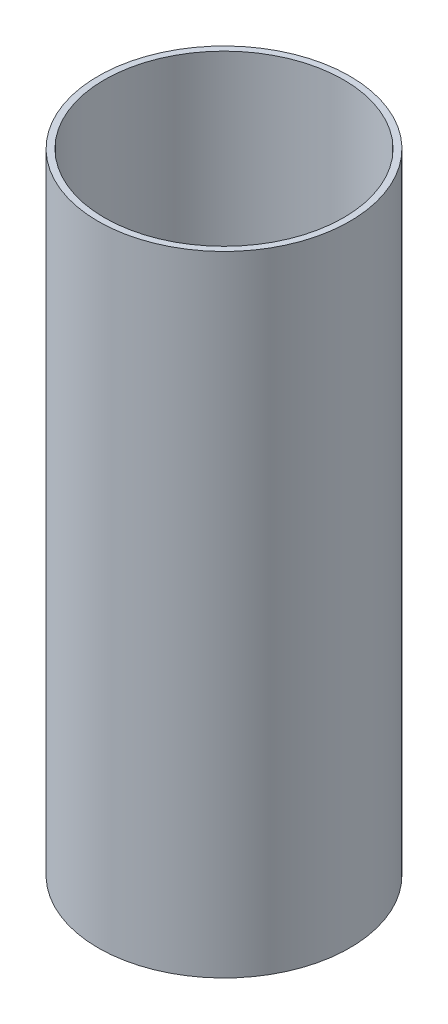
from build123d import *

# Parameters (mm, degrees)
SKETCH1_R           = 40
SKETCH1_R_2         = 38
BOSS_EXTRUDE1_DEPTH = 200


with BuildPart() as part:
    # Sketch1 → Boss-Extrude1 (new body)
    with BuildSketch(Plane(origin=(0, 0, 0), x_dir=(1, 0, 0), z_dir=(0, 1, 0))):
        with Locations(Location((0, 0, 0), (0, 0, 270))):
            Circle(SKETCH1_R)
        with Locations(Location((0, 0, 0), (0, 0, 270))):
            Circle(SKETCH1_R_2, mode=Mode.SUBTRACT)
    extrude(amount=BOSS_EXTRUDE1_DEPTH)


solid = part.part
